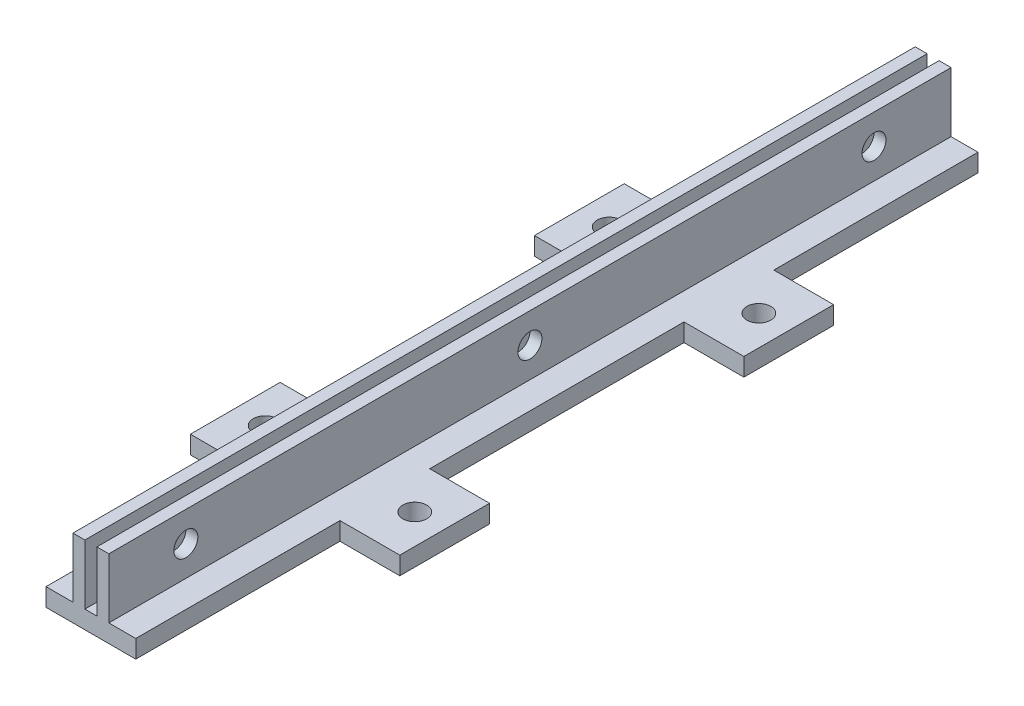
from build123d import *

# Parameters (mm, degrees)
BOSS_EXTRUDE1_DEPTH = 5
BOSS_EXTRUDE2_DEPTH = 3
SKETCH3_W           = 2
SKETCH3_H           = 170
BOSS_EXTRUDE3_DEPTH = 10
SKETCH5_R           = 2
CUT_EXTRUDE1_DEPTH  = 10
SKETCH6_R           = 2
CUT_EXTRUDE3_DEPTH  = 5
SKETCH8_W           = 55
SKETCH8_H           = 14.626241735
CUT_EXTRUDE4_DEPTH  = 20
SKETCH9_W           = 140.74751653
SKETCH9_H           = 5
CUT_EXTRUDE5_DEPTH  = 300


with BuildPart() as part:
    # Sketch1 → Boss-Extrude1 (new body)
    with BuildSketch(Plane(origin=(0, 0, 0), x_dir=(1, 0, 0), z_dir=(0, 1, 0))):
        with BuildLine():
            Line((-27.5, 42.873758265), (-27.5, 13.75))
            ThreePointArc((-27.5, 13.75), (-13.75, 0), (-27.5, -13.75))
            Line((-27.5, -13.75), (-27.5, -42.873758265))
            ThreePointArc((-27.5, -42.873758265), (-13.75, -56.623758265), (-27.5, -70.373758265))
            Line((-27.5, -70.373758265), (-27.5, -85))
            Line((-27.5, -85), (27.5, -85))
            Line((27.5, -85), (27.5, -70.373758265))
            ThreePointArc((27.5, -70.373758265), (13.75, -56.623758265), (27.5, -42.873758265))
            Line((27.5, -42.873758265), (27.5, -13.75))
            ThreePointArc((27.5, -13.75), (13.75, 0), (27.5, 13.75))
            Line((27.5, 13.75), (27.5, 42.873758265))
            ThreePointArc((27.5, 42.873758265), (13.75, 56.623758265), (27.5, 70.373758265))
            Line((27.5, 70.373758265), (27.5, 85))
            Line((27.5, 85), (-27.5, 85))
            Line((-27.5, 85), (-27.5, 70.373758265))
            ThreePointArc((-27.5, 70.373758265), (-13.75, 56.623758265), (-27.5, 42.873758265))
        make_face()
    extrude(amount=BOSS_EXTRUDE1_DEPTH)

    # Sketch2 → Boss-Extrude2 (add)
    with BuildSketch(Plane(origin=(0, 5, 0), x_dir=(1, 0, 0), z_dir=(0, 1, 0))):
        Polygon((-7.5, 85), (7.5, 85), (7.5, 36.25), (17.5, 36.25), (17.5, 21.25), (7.5, 21.25), (7.5, -21.25), (17.5, -21.25), (17.5, -36.25), (7.5, -36.25), (7.5, -85), (-7.5, -85), (-7.5, -36.25), (-17.5, -36.25), (-17.5, -21.25), (-7.5, -21.25), (-7.5, 21.25), (-17.5, 21.25), (-17.5, 36.25), (-7.5, 36.25), align=None)
    extrude(amount=BOSS_EXTRUDE2_DEPTH)

    # Sketch3 → Boss-Extrude3 (add)
    with BuildSketch(Plane(origin=(0, 8, 0), x_dir=(1, 0, 0), z_dir=(0, 1, 0))):
        with Locations((-2, 0)):
            Rectangle(SKETCH3_W, SKETCH3_H)
        with Locations((2, 0)):
            Rectangle(SKETCH3_W, SKETCH3_H)
    extrude(amount=BOSS_EXTRUDE3_DEPTH)

    # Sketch5 → Cut-Extrude1 (cut)
    with BuildSketch(Plane.ZY.offset(3)):
        with Locations((0, 13)):
            Circle(SKETCH5_R)
        with Locations((-57.5, 13)):
            Circle(SKETCH5_R)
        with Locations((57.5, 13)):
            Circle(SKETCH5_R)
    extrude(amount=-CUT_EXTRUDE1_DEPTH, mode=Mode.SUBTRACT)

    # Sketch6 → Cut-Extrude3 (cut)
    with BuildSketch(Plane(origin=(0, 8, 0), x_dir=(1, 0, 0), z_dir=(0, 1, 0))):
        with Locations(Location((-12.5, 28.75, 0), (0, 0, 270))):
            Circle(SKETCH6_R)
        with Locations(Location((12.5, 28.75, 0), (0, 0, 90))):
            Circle(SKETCH6_R)
        with Locations(Location((12.5, -28.75, 0), (0, 0, 270))):
            Circle(SKETCH6_R)
        with Locations(Location((-12.5, -28.75, 0), (0, 0, 90))):
            Circle(SKETCH6_R)
    extrude(amount=-CUT_EXTRUDE3_DEPTH, mode=Mode.SUBTRACT)

    # Sketch8 → Cut-Extrude4 (cut)
    with BuildSketch(Plane(origin=(0, 18, 0), x_dir=(1, 0, 0), z_dir=(0, 1, 0))):
        with Locations((0, 77.686879132)):
            Rectangle(SKETCH8_W, SKETCH8_H)
        with Locations((0, -77.686879132)):
            Rectangle(SKETCH8_W, SKETCH8_H)
    extrude(amount=-CUT_EXTRUDE4_DEPTH, mode=Mode.SUBTRACT)

    # Sketch9 → Cut-Extrude5 (cut)
    with BuildSketch(Plane.ZY.offset(27.5)):
        with Locations((0, 2.5)):
            Rectangle(SKETCH9_W, SKETCH9_H)
    extrude(amount=-CUT_EXTRUDE5_DEPTH, mode=Mode.SUBTRACT)


solid = part.part
